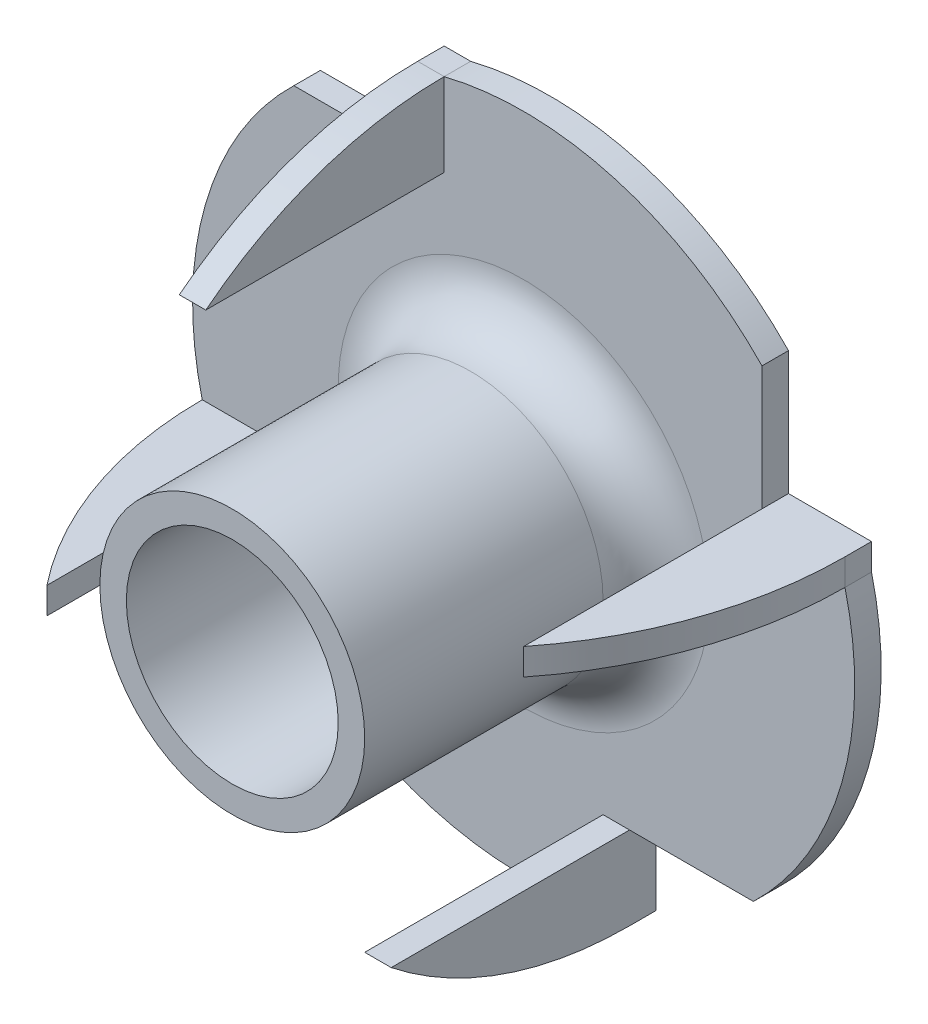
from build123d import *

# Parameters (mm, degrees)
CUT_EXTRUDE1_REACH  = 22.821
SKETCH2_W           = 5.674675786
SKETCH2_H           = 3.1346611
BOSS_EXTRUDE1_DEPTH = 1
CIRPATTERN1_COUNT   = 4


with BuildPart() as part:
    # Sketch1 → Revolve-Thin2 (revolve)
    with BuildSketch(Plane.YZ, mode=Mode.PRIVATE) as revolve_thin2_sk:
        with BuildLine():
            Line((5, 11), (5, 2))
            ThreePointArc((5, 2), (5.585786438, 0.585786438), (7, 0))
            Line((7, 0), (12.5, 0))
            Line((12.5, 0), (12.5, -1))
            Line((12.5, -1), (7, -1))
            ThreePointArc((7, -1), (4.878679656, -0.121320344), (4, 2))
            Line((4, 2), (4, 11))
            Line((4, 11), (5, 11))
        make_face()
    revolve(revolve_thin2_sk.sketch.rotate(Axis((0, 0, 14.992157351), (0, 0, -1)), 90), axis=Axis((0, 0, 14.992157351), (0, 0, -1)))

    # Sketch2 → Cut-Extrude1 (cut, up to next)
    with BuildSketch(Plane(origin=(0, 0, 0), x_dir=(0, 1, 0), z_dir=(0, 0, 1)), mode=Mode.PRIVATE) as cut_extrude1_sk1:
        with Locations((-5.837337893, 10.56733055)):
            Rectangle(SKETCH2_W, SKETCH2_H)
    cut_extrude1_tool1 = extrude(cut_extrude1_sk1.sketch, amount=-CUT_EXTRUDE1_REACH, mode=Mode.PRIVATE) & part.part
    cut_extrude1 = cut_extrude1_tool1.solids().sort_by_distance((-10.567331, -5.837338, 0))[0]
    add(cut_extrude1, mode=Mode.SUBTRACT)

    # Sketch3 → Boss-Extrude1 (add)
    with BuildSketch(Plane.XZ.offset(3)):
        with BuildLine():
            Line((-9, -1), (-9, 9))
            ThreePointArc((-9, 9), (-11.328570013, 4.765136415), (-12.1346611, 0))
            Line((-12.1346611, 0), (-12.1346611, -1))
            Line((-12.1346611, -1), (-9, -1))
        make_face()
    boss_extrude1 = extrude(amount=BOSS_EXTRUDE1_DEPTH)

    # CirPattern1: Cut-Extrude1, Boss-Extrude1 ×4 about axis
    cirpattern1_axis = Axis((0, 0, 0), (0, 0, 1))
    add([cut_extrude1.rotate(cirpattern1_axis, i * 360 / CIRPATTERN1_COUNT) for i in range(1, CIRPATTERN1_COUNT)], mode=Mode.SUBTRACT)
    add([boss_extrude1.rotate(cirpattern1_axis, i * 360 / CIRPATTERN1_COUNT) for i in range(1, CIRPATTERN1_COUNT)])


solid = part.part
